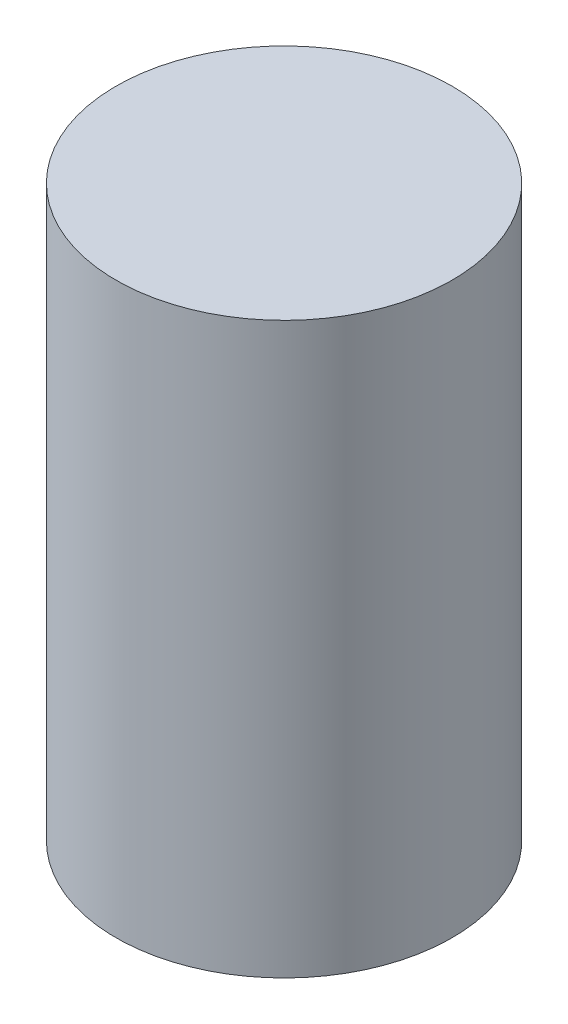
from build123d import *

# Parameters (mm, degrees)
SKETCH_1_R      = 540
EXTRUDE_1_DEPTH = 1830
SKETCH_4_R      = 21.15
EXTRUDE_4_DEPTH = 30


with BuildPart() as part:
    # Эскиз1 → Бобышка-Вытянуть1 (new body)
    with BuildSketch(Plane(origin=(0, 0, 0), x_dir=(1, 0, 0), z_dir=(0, 1, 0))):
        with Locations(Location((0, 0, 0), (0, 0, 90))):
            Circle(SKETCH_1_R)
    extrude(amount=EXTRUDE_1_DEPTH)

    # Эскиз4 → Бобышка-Вытянуть4 (add)
    with BuildSketch(Plane.XZ):
        with Locations(Location((0, 0, 0), (0, 0, 90))):
            Circle(SKETCH_4_R)
    extrude(amount=EXTRUDE_4_DEPTH)


solid = part.part
